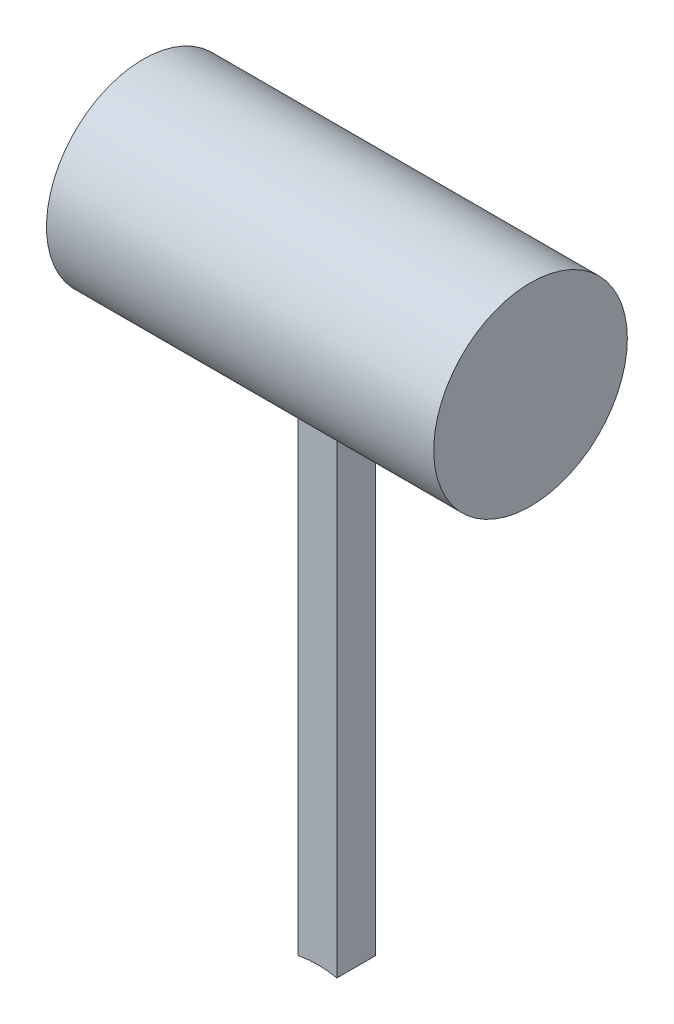
from build123d import *

# Parameters (mm, degrees)
SKETCH1_R           = 5
BOSS_EXTRUDE1_DEPTH = 10
BOSS_EXTRUDE2_DEPTH = 1


with BuildPart() as part:
    # Sketch1 → Boss-Extrude1 (new, symmetric)
    with BuildSketch(Plane(origin=(0, 0, 0), x_dir=(0, 0, -1), z_dir=(1, 0, 0))):
        Circle(SKETCH1_R)
    extrude(amount=BOSS_EXTRUDE1_DEPTH, both=True)

    # Sketch2 → Boss-Extrude2 (add, symmetric)
    with BuildSketch(Plane.XY):
        with BuildLine():
            Line((1, 0), (-1, 0))
            Line((-1, 0), (-1, -30.101020514))
            ThreePointArc((-1, -30.101020514), (0, -30), (1, -30.101020514))
            Line((1, -30.101020514), (1, 0))
        make_face()
    extrude(amount=BOSS_EXTRUDE2_DEPTH, both=True)


solid = part.part
